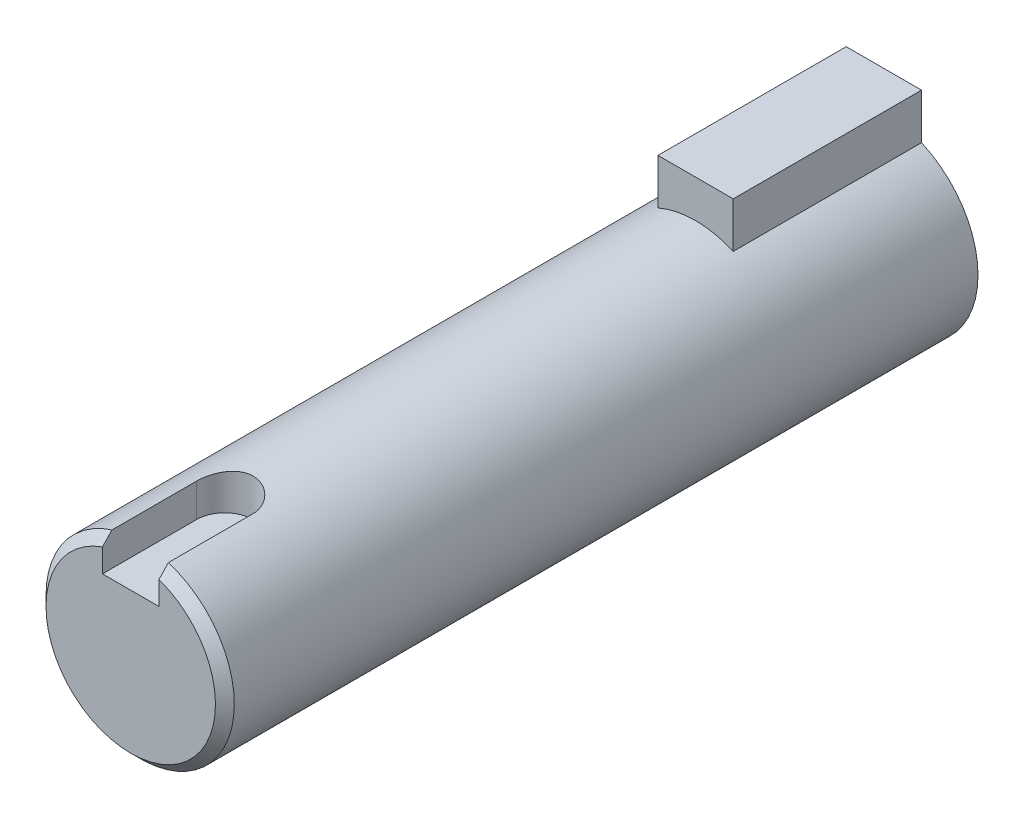
from build123d import *

# Parameters (mm, degrees)
BOSS_EXTRUDE1_DEPTH = 10
SKETCH2_R           = 5
BOSS_EXTRUDE2_DEPTH = 30
CUT_EXTRUDE1_START  = 3
CUT_EXTRUDE1_DEPTH  = 38.914545091
CHAMFER1_SIZE       = 0.5


with BuildPart() as part:
    # Sketch1 → Boss-Extrude1 (new body)
    with BuildSketch(Plane.XY):
        with BuildLine():
            Line((-2, 7), (2, 7))
            Line((2, 7), (2, 4.582575695))
            ThreePointArc((2, 4.582575695), (0, -5), (-2, 4.582575695))
            Line((-2, 4.582575695), (-2, 7))
        make_face()
    extrude(amount=BOSS_EXTRUDE1_DEPTH)

    # Sketch2 → Boss-Extrude2 (add)
    with BuildSketch(Plane.XY.offset(10)):
        with Locations(Location((0, 0, 0), (0, 0, 113.578178478))):
            Circle(SKETCH2_R)
    extrude(amount=BOSS_EXTRUDE2_DEPTH)

    # Sketch3 → Cut-Extrude1 (cut, through all)
    with BuildSketch(Plane(origin=(0, 0, 0), x_dir=(1, 0, 0), z_dir=(0, 1, 0)).offset(CUT_EXTRUDE1_START)):
        with BuildLine():
            Line((-1.5, -40), (-1.5, -35))
            ThreePointArc((-1.5, -35), (0, -33.5), (1.5, -35))
            Line((1.5, -35), (1.5, -40))
            ThreePointArc((1.5, -40), (0, -41.5), (-1.5, -40))
        make_face()
    extrude(amount=CUT_EXTRUDE1_DEPTH, mode=Mode.SUBTRACT)

    # Chamfer1
    chamfer1_edges = [part.edges().sort_by_distance(p)[0] for p in [
        (0.266933518, -4.992869565, 40),
    ]]
    chamfer(chamfer1_edges, length=CHAMFER1_SIZE)


solid = part.part
